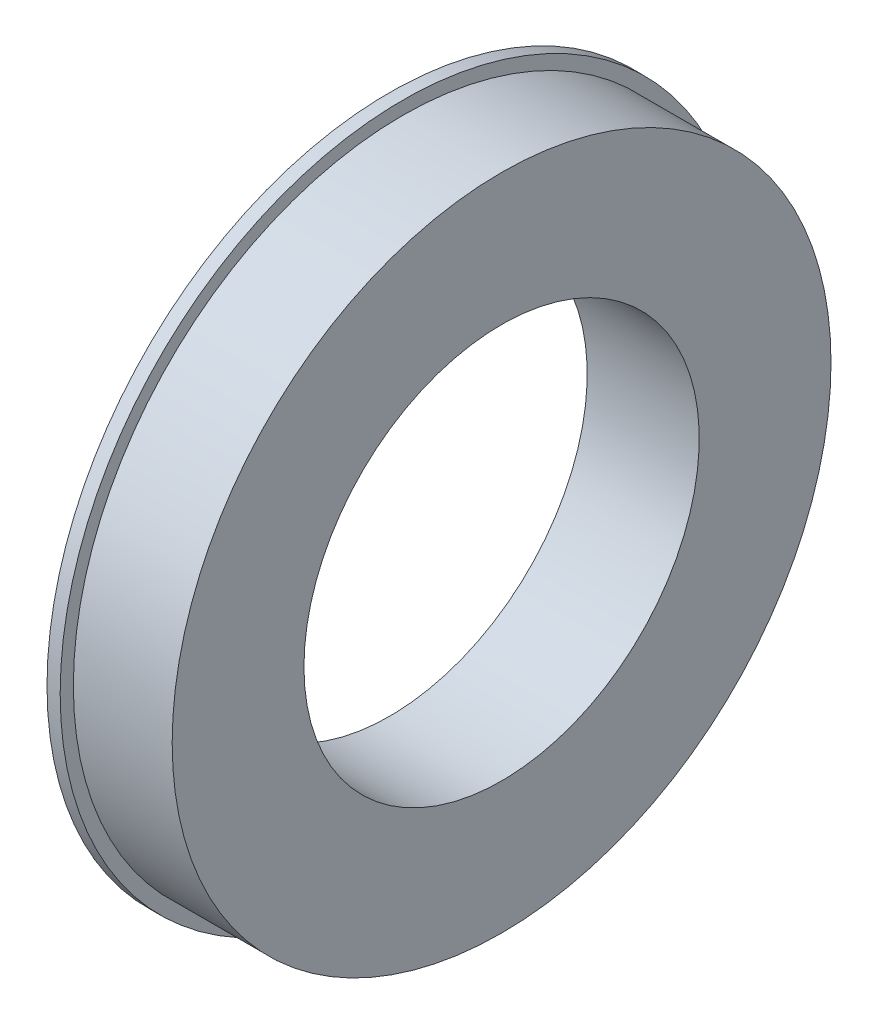
from build123d import *

# Parameters (mm, degrees)
SKETCH1_R           = 63.5
SKETCH1_R_2         = 38.1
BOSS_EXTRUDE1_DEPTH = 19.05
BOSS_EXTRUDE2_START = 2.54
SKETCH2_R           = 66.04
SKETCH2_R_2         = 38.1
BOSS_EXTRUDE2_DEPTH = 2.54


with BuildPart() as part:
    # Sketch1 → Boss-Extrude1 (new body)
    with BuildSketch(Plane.YZ):
        with Locations(Location((0, 0, 0), (0, 0, 90))):
            Circle(SKETCH1_R)
        with Locations(Location((0, 0, 0), (0, 0, 90))):
            Circle(SKETCH1_R_2, mode=Mode.SUBTRACT)
    extrude(amount=BOSS_EXTRUDE1_DEPTH)

    # Sketch2 → Boss-Extrude2 (add)
    with BuildSketch(Plane(origin=(0, 0, 0), x_dir=(0, -1, 0), z_dir=(-1, 0, 0)).offset(BOSS_EXTRUDE2_START)):
        with Locations(Location((0, 0, 0), (0, 0, 90))):
            Circle(SKETCH2_R)
        with Locations(Location((0, 0, 0), (0, 0, 90))):
            Circle(SKETCH2_R_2, mode=Mode.SUBTRACT)
    extrude(amount=-BOSS_EXTRUDE2_DEPTH)


solid = part.part
